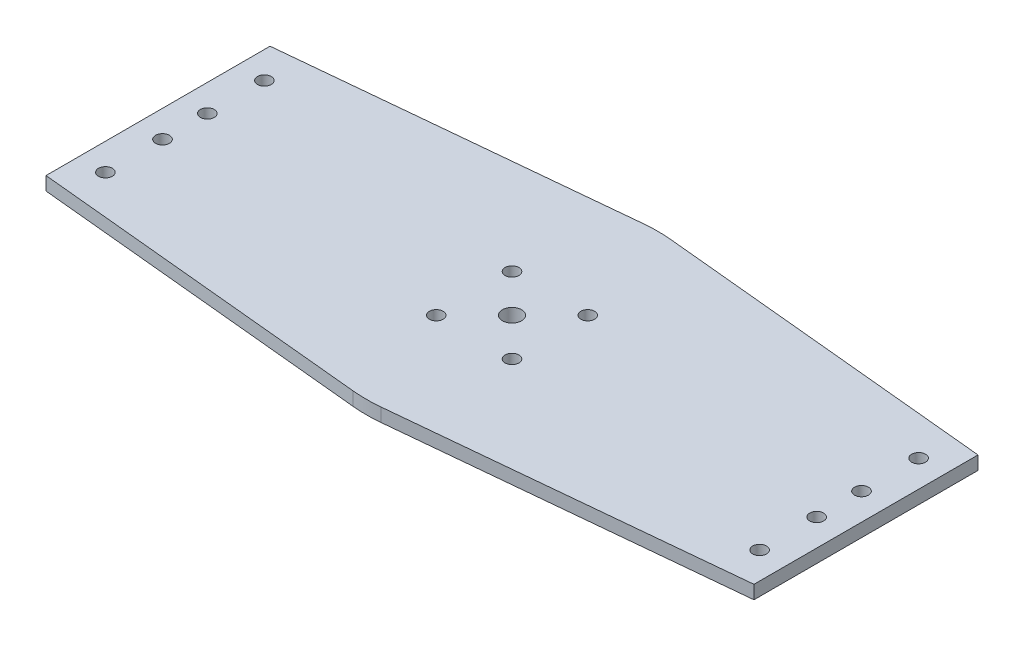
from build123d import *

# Parameters (mm, degrees)
EXTRUDE_1_DEPTH     = 3
SKETCH_2_R          = 1.55
SKETCH_2_R_2        = 2.15
CUT_EXTRUDE_1_DEPTH = 3
SKETCH_3_R          = 1.55
CUT_EXTRUDE_2_DEPTH = 4


with BuildPart() as part:
    # 草图1 → 凸台-拉伸1 (new body)
    with BuildSketch(Plane(origin=(0, 0, 0), x_dir=(1, 0, 0), z_dir=(0, 1, 0))):
        with BuildLine():
            Line((-79, 25), (-79, -25))
            Line((-79, -25), (-3.133353582, -32.34860268))
            ThreePointArc((-3.133353582, -32.34860268), (0, -32.5), (3.133353582, -32.34860268))
            Line((3.133353582, -32.34860268), (79, -25))
            Line((79, -25), (79, 25))
            Line((79, 25), (3.133353582, 32.34860268))
            ThreePointArc((3.133353582, 32.34860268), (0, 32.5), (-3.133353582, 32.34860268))
            Line((-3.133353582, 32.34860268), (-79, 25))
        make_face()
    extrude(amount=EXTRUDE_1_DEPTH)

    # 草图2 → 切除-拉伸1 (cut)
    with BuildSketch(Plane(origin=(0, 3, 0), x_dir=(1, 0, 0), z_dir=(0, 1, 0))):
        with Locations(Location((-8.45, 8.45, 0), (0, 0, 270))):
            Circle(SKETCH_2_R)
        with Locations(Location((8.45, 8.45, 0), (0, 0, 270))):
            Circle(SKETCH_2_R)
        with Locations(Location((8.45, -8.45, 0), (0, 0, 270))):
            Circle(SKETCH_2_R)
        with Locations(Location((-8.45, -8.45, 0), (0, 0, 270))):
            Circle(SKETCH_2_R)
        with Locations(Location((0, 0, 0), (0, 0, 270))):
            Circle(SKETCH_2_R_2)
    extrude(amount=-CUT_EXTRUDE_1_DEPTH, mode=Mode.SUBTRACT)

    # 草图3 → 切除-拉伸2 (cut)
    with BuildSketch(Plane.XZ):
        with Locations(Location((-73, 17.74, 0), (0, 0, 270))):
            Circle(SKETCH_3_R)
        with Locations(Location((-73, 5, 0), (0, 0, 270))):
            Circle(SKETCH_3_R)
        with Locations(Location((-73, -5, 0), (0, 0, 270))):
            Circle(SKETCH_3_R)
        with Locations(Location((-73, -17.74, 0), (0, 0, 270))):
            Circle(SKETCH_3_R)
    cut_extrude_2 = extrude(amount=-CUT_EXTRUDE_2_DEPTH, mode=Mode.SUBTRACT)

    # 镜向1: 切除-拉伸2 across plane
    add(cut_extrude_2.mirror(Plane(origin=(0, 0, 0), x_dir=(0, 0, 1), z_dir=(1, 0, 0))), mode=Mode.SUBTRACT)


solid = part.part
